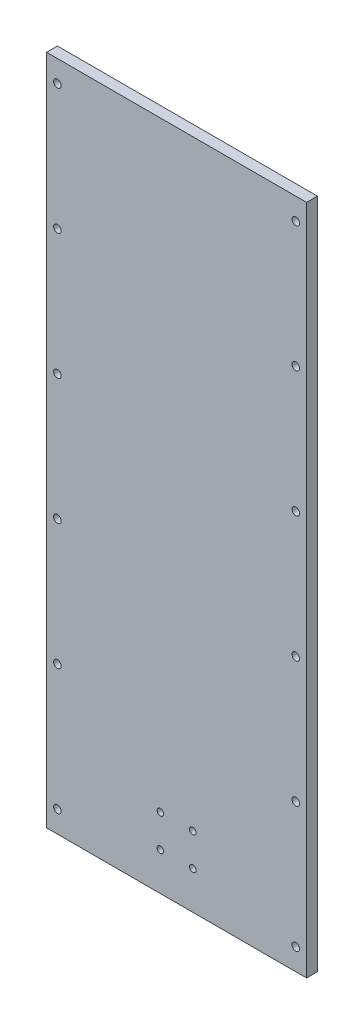
from build123d import *

# Parameters (mm, degrees)
ESQUISSE1_W             = 120
ESQUISSE1_H             = 310
BOSS_EXTRU_1_DEPTH      = 5
ESQUISSE2_R             = 1.747592995
ESQUISSE2_R_2           = 1.5
ENL_V_MAT_EXTRU_1_DEPTH = 10


with BuildPart() as part:
    # Esquisse1 → Boss.-Extru.1 (new body)
    with BuildSketch(Plane.XY):
        Rectangle(ESQUISSE1_W, ESQUISSE1_H)
    extrude(amount=BOSS_EXTRU_1_DEPTH)

    # Esquisse2 → Enlèv. mat.-Extru.1 (cut)
    with BuildSketch(Plane.XY.offset(5)):
        with Locations((-55, 145)):
            Circle(ESQUISSE2_R)
        with Locations((55, 145)):
            Circle(ESQUISSE2_R)
        with Locations((-55, 87)):
            Circle(ESQUISSE2_R)
        with Locations((-55, 29)):
            Circle(ESQUISSE2_R)
        with Locations((-55, -29)):
            Circle(ESQUISSE2_R)
        with Locations((-55, -87)):
            Circle(ESQUISSE2_R)
        with Locations((55, 87)):
            Circle(ESQUISSE2_R)
        with Locations((55, 29)):
            Circle(ESQUISSE2_R)
        with Locations((55, -29)):
            Circle(ESQUISSE2_R)
        with Locations((55, -87)):
            Circle(ESQUISSE2_R)
        with Locations((-7.5, -122.5)):
            Circle(ESQUISSE2_R_2)
        with Locations((7.5, -122.5)):
            Circle(ESQUISSE2_R_2)
        with Locations((7.5, -137.5)):
            Circle(ESQUISSE2_R_2)
        with Locations((-7.5, -137.5)):
            Circle(ESQUISSE2_R_2)
        with Locations((55, -145)):
            Circle(ESQUISSE2_R)
        with Locations((-55, -145)):
            Circle(ESQUISSE2_R)
    extrude(amount=-ENL_V_MAT_EXTRU_1_DEPTH, mode=Mode.SUBTRACT)


solid = part.part
